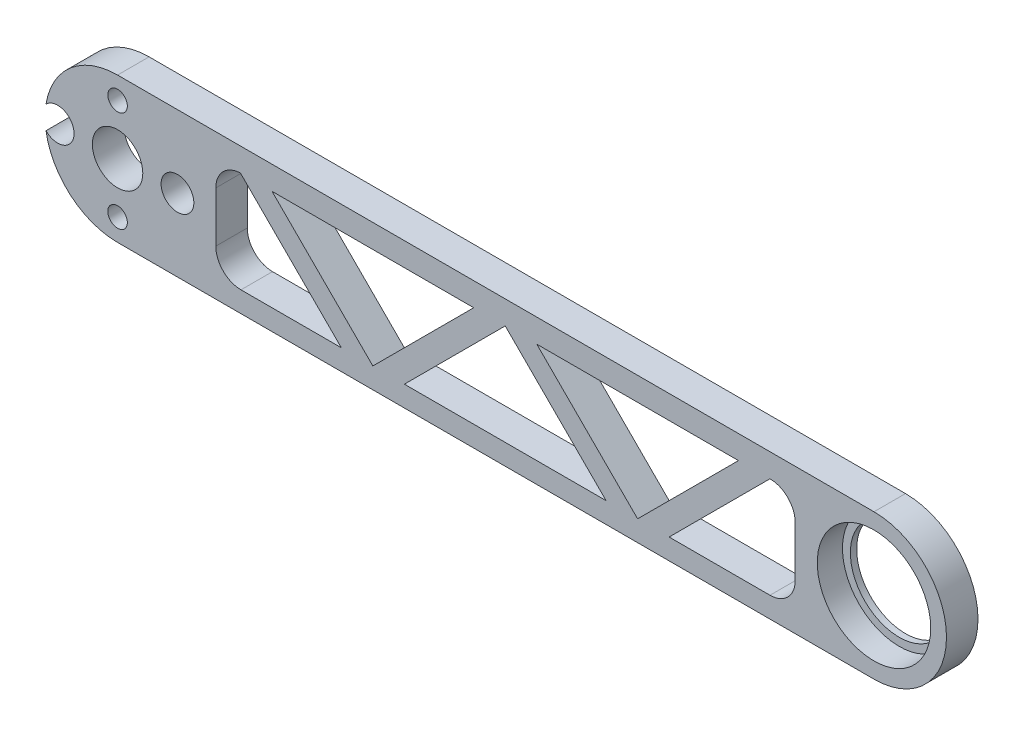
from build123d import *

# Parameters (mm, degrees)
BOSS_EXTRUDE1_DEPTH = 5
SKETCH2_R           = 9
CUT_EXTRUDE1_DEPTH  = 4
SKETCH3_R           = 7.75
CUT_EXTRUDE2_DEPTH  = 15
SKETCH4_R           = 4
CUT_EXTRUDE3_DEPTH  = 15
SKETCH5_R           = 1.55
CUT_EXTRUDE4_DEPTH  = 15
SKETCH6_R           = 2.6
CUT_EXTRUDE5_DEPTH  = 15
CUT_EXTRUDE7_DEPTH  = 15
CUT_EXTRUDE8_DEPTH  = 10
SKETCH9_R           = 2.75
CUT_EXTRUDE10_DEPTH = 2.8
BOSS_EXTRUDE2_DEPTH = 5


with BuildPart() as part:
    # Sketch1 → Boss-Extrude1 (new body)
    with BuildSketch(Plane.XY):
        with BuildLine():
            Line((0, 11.5), (120, 11.5))
            ThreePointArc((120, 11.5), (131.5, 0), (120, -11.5))
            Line((120, -11.5), (0, -11.5))
            ThreePointArc((0, -11.5), (-11.5, 0), (0, 11.5))
        make_face()
    extrude(amount=-BOSS_EXTRUDE1_DEPTH)

    # Sketch2 → Cut-Extrude1 (cut)
    with BuildSketch(Plane.XY):
        with Locations((120, 0)):
            Circle(SKETCH2_R)
    extrude(amount=-CUT_EXTRUDE1_DEPTH, mode=Mode.SUBTRACT)

    # Sketch3 → Cut-Extrude2 (cut)
    with BuildSketch(Plane.XY):
        with Locations((120, 0)):
            Circle(SKETCH3_R)
    extrude(amount=-CUT_EXTRUDE2_DEPTH, mode=Mode.SUBTRACT)

    # Sketch4 → Cut-Extrude3 (cut)
    with BuildSketch(Plane.XY):
        Circle(SKETCH4_R)
    extrude(amount=-CUT_EXTRUDE3_DEPTH, mode=Mode.SUBTRACT)

    # Sketch5 → Cut-Extrude4 (cut)
    with BuildSketch(Plane.XY):
        with Locations((0, 8)):
            Circle(SKETCH5_R)
        with Locations((0, -8)):
            Circle(SKETCH5_R)
    extrude(amount=-CUT_EXTRUDE4_DEPTH, mode=Mode.SUBTRACT)

    # Sketch6 → Cut-Extrude5 (cut)
    with BuildSketch(Plane.XY):
        with Locations((-9.5, 0)):
            Circle(SKETCH6_R)
        with Locations((9.5, 0)):
            Circle(SKETCH6_R)
    extrude(amount=-CUT_EXTRUDE5_DEPTH, mode=Mode.SUBTRACT)

    # Sketch8 → Cut-Extrude7 (cut)
    with BuildSketch(Plane.XY):
        with BuildLine():
            ThreePointArc((103.5, -8.220260856), (106.328427125, -7.048687981), (107.5, -4.220260856))
            Line((107.5, -4.220260856), (107.5, 3.779739144))
            ThreePointArc((107.5, 3.779739144), (106.328427125, 6.608166269), (103.5, 7.779739144))
            Line((103.5, 7.779739144), (61.5, 7.779739144))
            Line((61.5, 7.779739144), (77.5, -8.220260856))
            Line((77.5, -8.220260856), (103.5, -8.220260856))
        make_face()
        with BuildLine():
            Line((35.5, -8.220260856), (19.5, 7.779739144))
            ThreePointArc((19.5, 7.779739144), (16.722169997, 6.581192541), (15.578063312, 3.780500952))
            Line((15.578063312, 3.780500952), (15.578063312, -4.220260856))
            ThreePointArc((15.578063312, -4.220260856), (16.749636187, -7.048687981), (19.578063312, -8.220260856))
            Line((19.578063312, -8.220260856), (35.5, -8.220260856))
        make_face()
    extrude(amount=-CUT_EXTRUDE7_DEPTH, mode=Mode.SUBTRACT)

    # Sketch8<3> → Cut-Extrude8 (cut)
    with BuildSketch(Plane.XY):
        Polygon((40.5, -8.220260856), (56.5, 7.779739144), (24.5, 7.779739144), align=None)
        Polygon((77.5, -8.220260856), (61.5, 7.779739144), (45.5, -8.220260856), align=None)
    extrude(amount=-CUT_EXTRUDE8_DEPTH, mode=Mode.SUBTRACT)

    # Sketch9 → Cut-Extrude10 (cut)
    with BuildSketch(Plane(origin=(0, 0, -5), x_dir=(-1, 0, 0), z_dir=(0, 0, -1))):
        with Locations((0, 8)):
            Circle(SKETCH9_R)
        with Locations((0, -8)):
            Circle(SKETCH9_R)
    extrude(amount=-CUT_EXTRUDE10_DEPTH, mode=Mode.SUBTRACT)

    # Sketch8<4> → Boss-Extrude2 (add)
    with BuildSketch(Plane.XY):
        Polygon((82.5, -8.220260856), (66.5, 7.779739144), (61.5, 7.779739144), (77.5, -8.220260856), align=None)
        Polygon((87.5, -8.220260856), (103.5, 7.779739144), (98.5, 7.779739144), (82.5, -8.220260856), align=None)
    extrude(amount=-BOSS_EXTRUDE2_DEPTH)


solid = part.part
